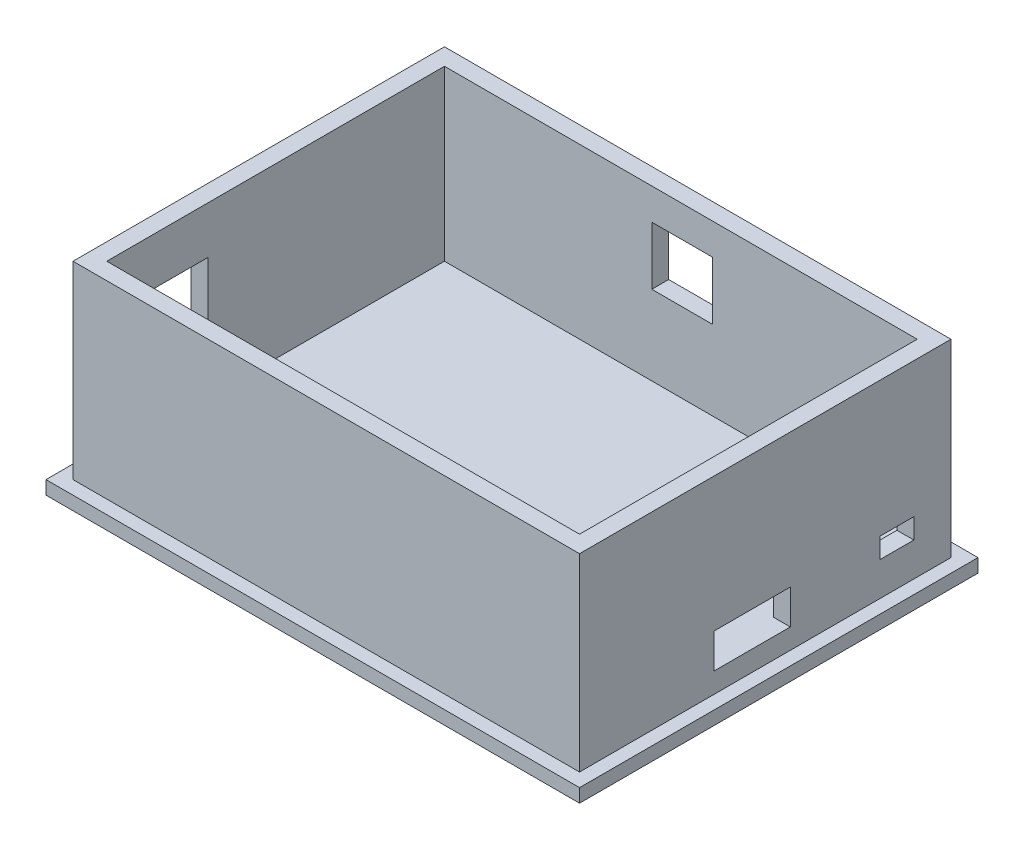
from build123d import *

# Parameters (mm, degrees)
SKETCH1_W           = 95.25
SKETCH1_H           = 69.85
BOSS_EXTRUDE1_DEPTH = 38.1
SKETCH2_W           = 88.9
SKETCH2_H           = 63.5
CUT_EXTRUDE1_DEPTH  = 31.75
CUT_EXTRUDE2_REACH  = 126.11
SKETCH3_W           = 6.35
SKETCH3_H           = 3.81
CUT_EXTRUDE3_REACH  = 126.11
SKETCH4_W           = 15.24
SKETCH4_H           = 10.16
SKETCH5_W           = 100.33
SKETCH5_H           = 74.93
BOSS_EXTRUDE2_DEPTH = 2.54
SKETCH6_W           = 11.43
SKETCH6_H           = 10.929541263
CUT_EXTRUDE4_DEPTH  = 6.35
SKETCH7_W           = 14.362267298
SKETCH7_H           = 6.50180408
CUT_EXTRUDE5_DEPTH  = 6.35


with BuildPart() as part:
    # Sketch1 → Boss-Extrude1 (new body)
    with BuildSketch(Plane(origin=(0, 0, 0), x_dir=(1, 0, 0), z_dir=(0, 1, 0))):
        with Locations((47.625, 34.925)):
            Rectangle(SKETCH1_W, SKETCH1_H)
    extrude(amount=BOSS_EXTRUDE1_DEPTH)

    # Sketch2 → Cut-Extrude1 (cut)
    with BuildSketch(Plane(origin=(0, 38.1, 0), x_dir=(1, 0, 0), z_dir=(0, 1, 0))):
        with Locations((47.625, 34.925)):
            Rectangle(SKETCH2_W, SKETCH2_H)
    extrude(amount=-CUT_EXTRUDE1_DEPTH, mode=Mode.SUBTRACT)

    # Sketch3 → Cut-Extrude2 (cut, up to next)
    with BuildSketch(Plane(origin=(95.25, 0, 0), x_dir=(0, 0, -1), z_dir=(1, 0, 0)), mode=Mode.PRIVATE) as cut_extrude2_sk1:
        with Locations((59.69, 10.795)):
            Rectangle(SKETCH3_W, SKETCH3_H)
    cut_extrude2_tool1 = extrude(cut_extrude2_sk1.sketch, amount=-CUT_EXTRUDE2_REACH, mode=Mode.PRIVATE) & part.part
    add(cut_extrude2_tool1.solids().sort_by_distance((95.25, 10.795, -59.69))[0], mode=Mode.SUBTRACT)

    # Sketch4 → Cut-Extrude3 (cut, up to next)
    with BuildSketch(Plane.ZY, mode=Mode.PRIVATE) as cut_extrude3_sk1:
        with Locations((-14.605, 24.13)):
            Rectangle(SKETCH4_W, SKETCH4_H)
    cut_extrude3_tool1 = extrude(cut_extrude3_sk1.sketch, amount=-CUT_EXTRUDE3_REACH, mode=Mode.PRIVATE) & part.part
    add(cut_extrude3_tool1.solids().sort_by_distance((0, 24.13, -14.605))[0], mode=Mode.SUBTRACT)

    # Sketch5 → Boss-Extrude2 (add)
    with BuildSketch(Plane.XZ):
        with Locations((47.625, -34.925)):
            Rectangle(SKETCH5_W, SKETCH5_H)
    extrude(amount=-BOSS_EXTRUDE2_DEPTH)

    # Sketch6 → Cut-Extrude4 (cut)
    with BuildSketch(Plane(origin=(0, 0, -69.85), x_dir=(-1, 0, 0), z_dir=(0, 0, -1))):
        with Locations((-47.879, 26.743022326)):
            Rectangle(SKETCH6_W, SKETCH6_H)
    extrude(amount=-CUT_EXTRUDE4_DEPTH, mode=Mode.SUBTRACT)

    # Sketch7 → Cut-Extrude5 (cut)
    with BuildSketch(Plane(origin=(95.25, 0, 0), x_dir=(0, 0, -1), z_dir=(1, 0, 0))):
        with Locations((32.45447078, 9.60090204)):
            Rectangle(SKETCH7_W, SKETCH7_H)
    extrude(amount=-CUT_EXTRUDE5_DEPTH, mode=Mode.SUBTRACT)


solid = part.part
